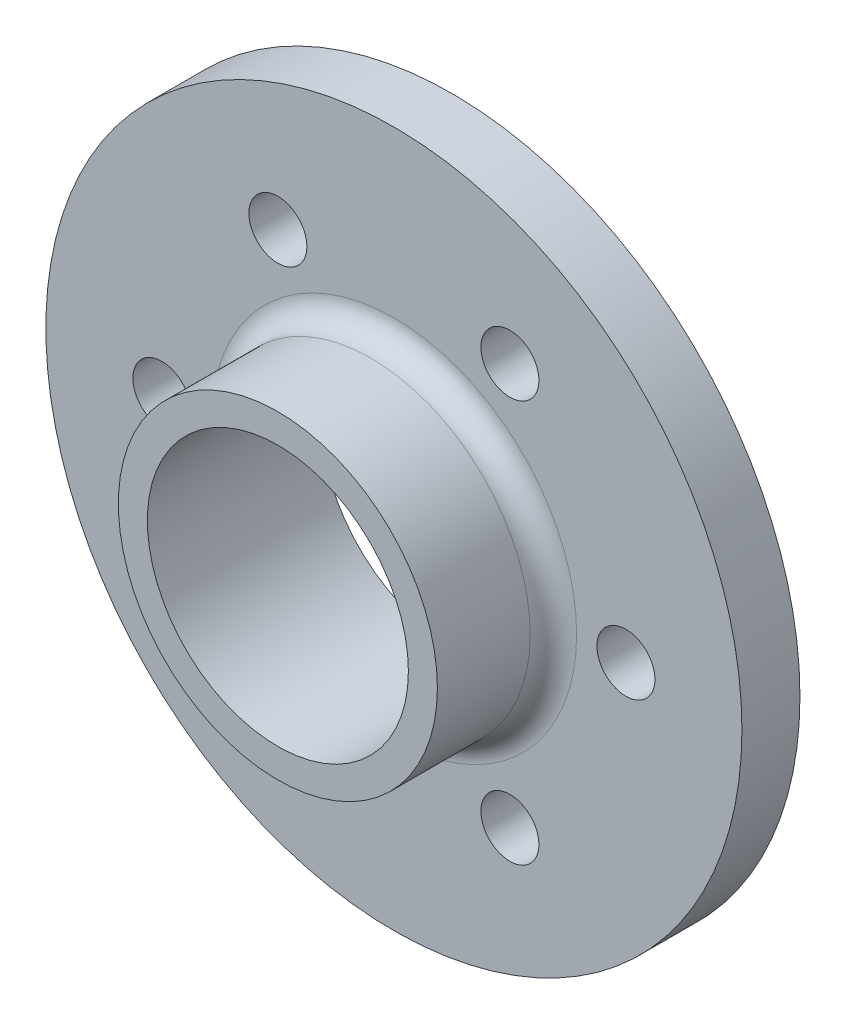
from build123d import *

# Parameters (mm, degrees)
SKETCH1_R           = 38.1
BOSS_EXTRUDE1_DEPTH = 6.35
SKETCH2_R           = 17.4625
BOSS_EXTRUDE2_DEPTH = 12.7
FILLET2_R           = 2.54
CUT_EXTRUDE1_REACH  = 59.15
SKETCH3_R           = 14.2875
SKETCH4_R           = 3.175
CUT_EXTRUDE2_DEPTH  = 58.15


with BuildPart() as part:
    # Sketch1 → Boss-Extrude1 (new body)
    with BuildSketch(Plane.XY):
        Circle(SKETCH1_R)
    extrude(amount=BOSS_EXTRUDE1_DEPTH)

    # Sketch2 → Boss-Extrude2 (add)
    with BuildSketch(Plane.XY.offset(6.35)):
        Circle(SKETCH2_R)
    extrude(amount=BOSS_EXTRUDE2_DEPTH)

    # Fillet2
    fillet2_edges = [part.edges().sort_by_distance(p)[0] for p in [
        (-17.4625, 0, 6.35),
    ]]
    fillet(fillet2_edges, radius=FILLET2_R)

    # Sketch3 → Cut-Extrude1 (cut, up to next)
    with BuildSketch(Plane.XY.offset(19.05), mode=Mode.PRIVATE) as cut_extrude1_sk1:
        Circle(SKETCH3_R)
    cut_extrude1_tool1 = extrude(cut_extrude1_sk1.sketch, amount=-CUT_EXTRUDE1_REACH, mode=Mode.PRIVATE) & part.part
    add(cut_extrude1_tool1.solids().sort_by_distance((0, 0, 19.05))[0], mode=Mode.SUBTRACT)

    # Sketch4 → Cut-Extrude2 (cut, through all)
    with BuildSketch(Plane(origin=(0, 0, 0), x_dir=(-1, 0, 0), z_dir=(0, 0, -1))):
        with Locations((-25.4, 0)):
            Circle(SKETCH4_R)
        with Locations((-12.7, 21.997045256)):
            Circle(SKETCH4_R)
        with Locations((12.7, 21.997045256)):
            Circle(SKETCH4_R)
        with Locations((25.4, 0)):
            Circle(SKETCH4_R)
        with Locations((12.7, -21.997045256)):
            Circle(SKETCH4_R)
        with Locations((-12.7, -21.997045256)):
            Circle(SKETCH4_R)
    extrude(amount=-CUT_EXTRUDE2_DEPTH, mode=Mode.SUBTRACT)


solid = part.part
